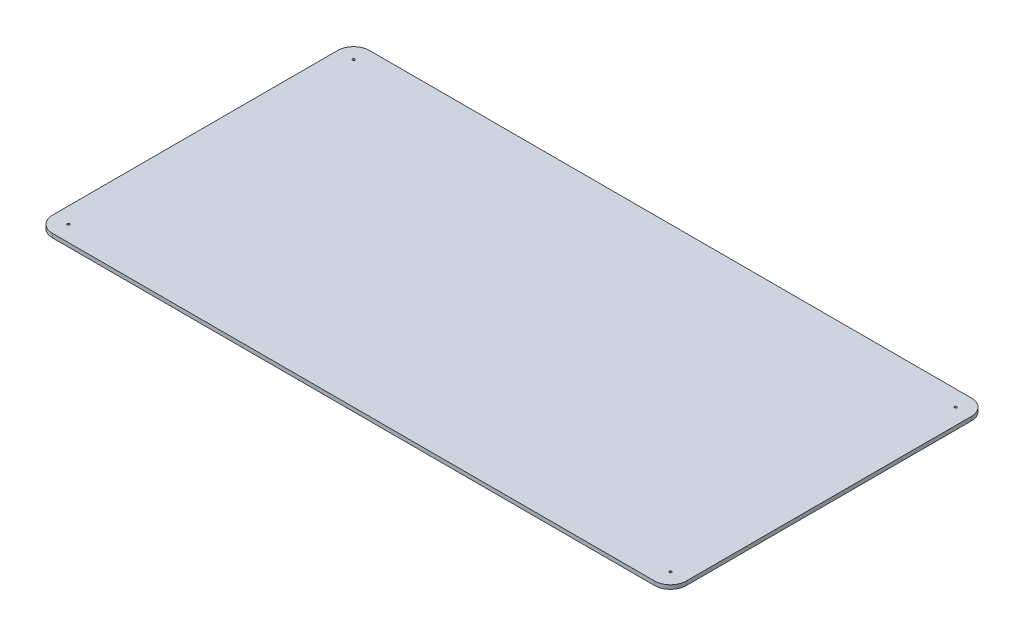
from build123d import *

# Parameters (mm, degrees)
SKETCH1_W           = 800
SKETCH1_H           = 400
BOSS_EXTRUDE1_DEPTH = 5
FILLET1_R           = 20
SKETCH2_R           = 1.5
CUT_EXTRUDE1_DEPTH  = 895.441166316


with BuildPart() as part:
    # Sketch1 → Boss-Extrude1 (new body)
    with BuildSketch(Plane(origin=(0, 0, 0), x_dir=(1, 0, 0), z_dir=(0, 1, 0))):
        with Locations((400, 200)):
            Rectangle(SKETCH1_W, SKETCH1_H)
    extrude(amount=BOSS_EXTRUDE1_DEPTH)

    # Fillet1
    fillet1_edges = [part.edges().sort_by_distance(p)[0] for p in [
        (0, 2.5, -400),
        (800, 2.5, -400),
        (800, 2.5, 0),
        (0, 2.5, 0),
    ]]
    fillet(fillet1_edges, radius=FILLET1_R)

    # Sketch2 → Cut-Extrude1 (cut, through all)
    with BuildSketch(Plane(origin=(0, 5, 0), x_dir=(1, 0, 0), z_dir=(0, 1, 0))):
        with Locations(Location((20, 380, 0), (0, 0, 270))):
            Circle(SKETCH2_R)
        with Locations(Location((780, 380, 0), (0, 0, 90))):
            Circle(SKETCH2_R)
        with Locations(Location((780, 20, 0), (0, 0, 270))):
            Circle(SKETCH2_R)
        with Locations(Location((20, 20, 0), (0, 0, 90))):
            Circle(SKETCH2_R)
    extrude(amount=-CUT_EXTRUDE1_DEPTH, mode=Mode.SUBTRACT)


solid = part.part
